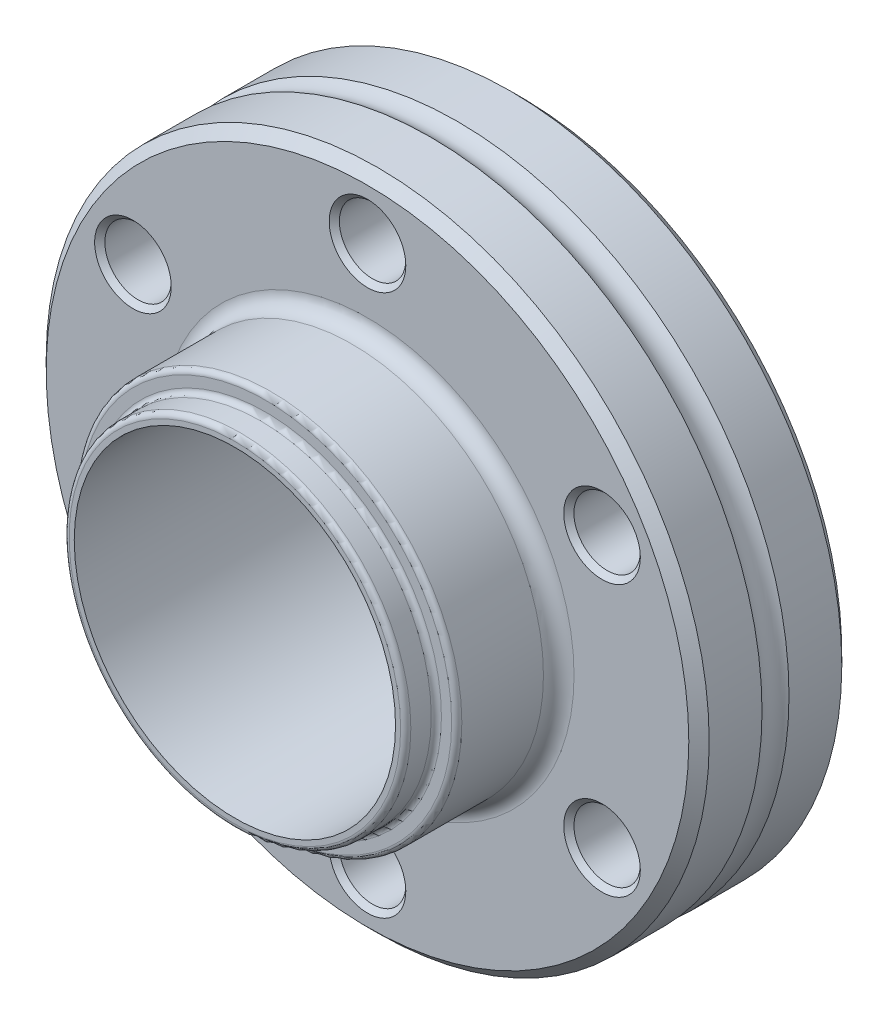
from build123d import *

# Parameters (mm, degrees)
SKETCH2_R                 = 9.525
BOSS_EXTRUDE1_DEPTH       = 5.08
SKETCH3_R                 = 8.509
BOSS_EXTRUDE2_DEPTH       = 1.524
HOLE1_D                   = 16.002
HOLE1_DEPTH               = 14.224
F_4_CLEARANCE_HOLE1_D     = 3.30708
F_4_CLEARANCE_HOLE2_D     = 3.30708
F_4_CLEARANCE_HOLE2_DEPTH = 14.224
CHAMFER1_SIZE             = 0.254
CHAMFER2_SIZE             = 0.508
FILLET1_R                 = 0.254
FILLET2_R                 = 0.762


with BuildPart() as part:
    # Sketch1 → Revolve1 (revolve)
    with BuildSketch(Plane(origin=(0, 0, 0), x_dir=(1, 0, 0), z_dir=(0, 1, 0))):
        with BuildLine():
            Line((9.086103121, 5.9436), (0, 5.9436))
            Line((0, 5.9436), (0, -0.508))
            Line((0, -0.508), (16.51, -0.508))
            Line((16.51, -0.508), (16.51, 2.629979167))
            ThreePointArc((16.51, 2.629979167), (16.256, 3.302), (16.51, 3.974020833))
            Line((16.51, 3.974020833), (16.51, 7.112))
            Line((16.51, 7.112), (10.7315, 7.112))
            Line((10.7315, 7.112), (10.7315, 5.920021473))
            Line((10.7315, 5.920021473), (9.271, 6.4516))
            Line((9.271, 6.4516), (9.086103121, 5.9436))
        make_face()
    revolve(axis=Axis((0, 0, -7.112), (0, 0, 1)))

    # Sketch2 → Boss-Extrude1 (add)
    with BuildSketch(Plane.XY.offset(0.508)):
        Circle(SKETCH2_R)
    extrude(amount=BOSS_EXTRUDE1_DEPTH)

    # Sketch3 → Boss-Extrude2 (add)
    with BuildSketch(Plane.XY.offset(5.588)):
        Circle(SKETCH3_R)
    extrude(amount=BOSS_EXTRUDE2_DEPTH)

    # Hole1
    with Locations(Plane.XY.offset(7.112)):
        with Locations((0, 0)):
            Hole(HOLE1_D / 2, depth=HOLE1_DEPTH)

    # #4 Clearance Hole1 (through all)
    with Locations(Plane.XY.offset(0.508)):
        with Locations((11.680431031, -6.7437)):
            Hole(F_4_CLEARANCE_HOLE1_D / 2)

    # #4 Clearance Hole2
    with Locations(Plane(origin=(0, 0, -7.112), x_dir=(-1, 0, 0), z_dir=(0, 0, -1))):
        with Locations((0, 13.4874), (11.680431031, 6.7437), (11.680431031, -6.7437), (0, -13.4874), (-11.680431031, 6.7437)):
            Hole(F_4_CLEARANCE_HOLE2_D / 2, depth=F_4_CLEARANCE_HOLE2_DEPTH)

    # Chamfer1
    chamfer1_edges = [part.edges().sort_by_distance(p)[0] for p in [
        (13.333971031, -6.7437, 0.508),
        (13.333971031, -6.7437, -7.112),
        (10.026891031, 6.7437, 0.508),
        (10.026891031, 6.7437, -7.112),
        (-1.65354, -13.4874, 0.508),
        (-1.65354, -13.4874, -7.112),
        (-13.333971031, -6.7437, 0.508),
        (-13.333971031, -6.7437, -7.112),
        (-13.333971031, 6.7437, 0.508),
        (-13.333971031, 6.7437, -7.112),
        (-1.65354, 13.4874, 0.508),
        (-1.65354, 13.4874, -7.112),
    ]]
    chamfer(chamfer1_edges, length=CHAMFER1_SIZE)

    # Chamfer2
    chamfer2_edges = [part.edges().sort_by_distance(p)[0] for p in [
        (-16.51, 0, 0.508),
        (-16.51, 0, -7.112),
    ]]
    chamfer(chamfer2_edges, length=CHAMFER2_SIZE)

    # Fillet1
    fillet1_edges = [part.edges().sort_by_distance(p)[0] for p in [
        (-9.525, 0, 5.588),
        (-8.509, 0, 5.588),
        (-8.509, 0, 7.112),
        (8.001, 0, -5.9436),
    ]]
    fillet(fillet1_edges, radius=FILLET1_R)

    # Fillet2
    fillet2_edges = [part.edges().sort_by_distance(p)[0] for p in [
        (-9.525, 0, 0.508),
    ]]
    fillet(fillet2_edges, radius=FILLET2_R)


solid = part.part
